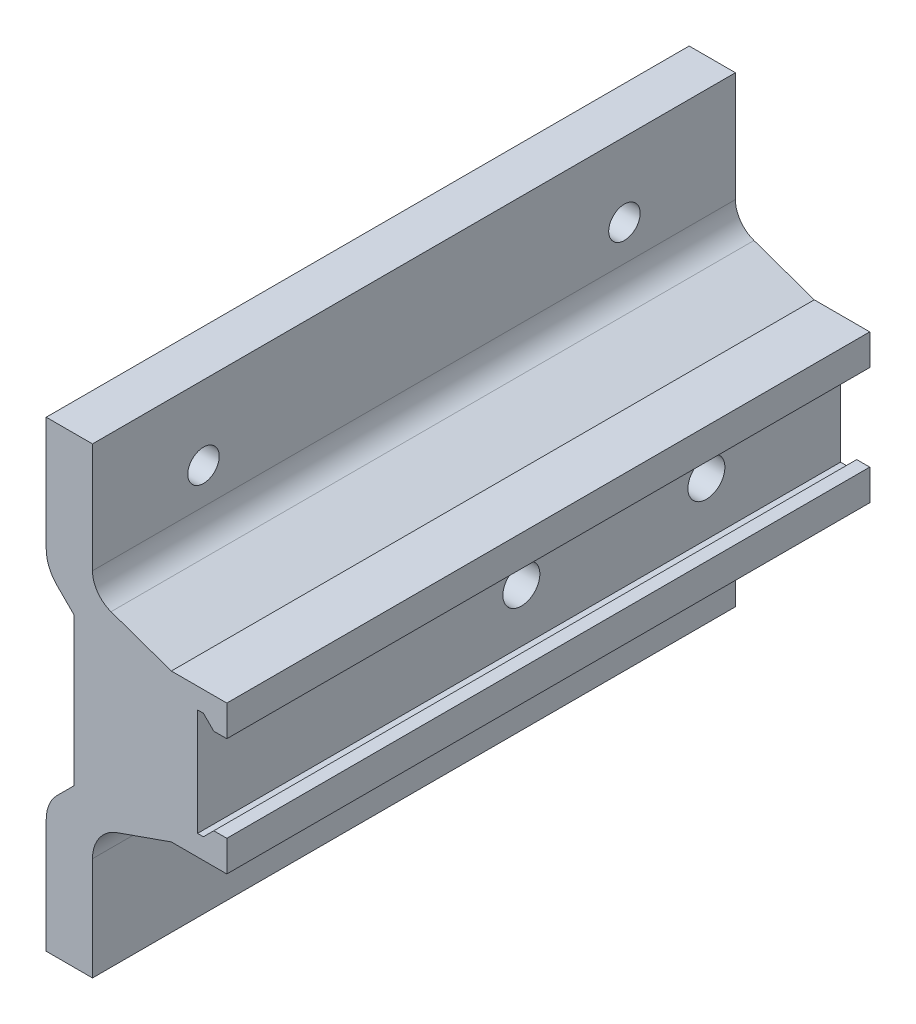
from build123d import *

# Parameters (mm, degrees)
BOSS_EXTRUDE2_DEPTH     = 69.5
BOSS_EXTRUDE3_DEPTH     = 69.5
CUT_EXTRUDE1_DEPTH      = 77.467274154
CUT_EXTRUDE1_DEPTH_BACK = 77.467274154
SKETCH7_R               = 2
CUT_EXTRUDE2_DEPTH      = 78.205129928
CUT_EXTRUDE2_DEPTH_BACK = 78.205129928
SKETCH8_R               = 1.7


with BuildPart() as part:
    # Sketch4 → Boss-Extrude2 (new body)
    with BuildSketch(Plane.XY):
        Polygon((-4.302602112, 10.373468411), (-10.302602112, 10.373468411), (-10.302602112, -5.626531589), (-4.302602112, -5.626531589), (-4.302602112, -2.286531589), (-5.712602112, -2.286531589), (-6.832602112, -3.406531589), (-7.462602112, -3.406531589), (-7.462602112, 8.153468411), (-6.832602112, 8.153468411), (-5.712602112, 7.033468411), (-4.302602112, 7.033468411), align=None)
    extrude(amount=BOSS_EXTRUDE2_DEPTH)

    # Sketch6 → Boss-Extrude3 (add)
    with BuildSketch(Plane.XY.offset(69.5)):
        with BuildLine():
            Line((-18.82375255, 27.373468411), (-23.82375255, 27.373468411))
            Line((-23.82375255, 27.373468411), (-23.82375255, 15.03032266))
            ThreePointArc((-23.82375255, 15.03032266), (-23.51927068, 13.499588931), (-22.652179675, 12.201895535))
            Line((-22.652179675, 12.201895535), (-20.82375255, 10.373468411))
            Line((-20.82375255, 10.373468411), (-20.82375255, -5.626531589))
            Line((-20.82375255, -5.626531589), (-22.652179675, -7.454958714))
            ThreePointArc((-22.652179675, -7.454958714), (-23.51927068, -8.752652109), (-23.82375255, -10.283385839))
            Line((-23.82375255, -10.283385839), (-23.82375255, -22.626531589))
            Line((-23.82375255, -22.626531589), (-18.82375255, -22.626531589))
            Line((-18.82375255, -22.626531589), (-18.82375255, -11.458931103))
            ThreePointArc((-18.82375255, -11.458931103), (-18.088209901, -9.14736925), (-16.152093449, -7.685933561))
            Line((-16.152093449, -7.685933561), (-10.302602112, -5.626531589))
            Line((-10.302602112, -5.626531589), (-10.302602112, 10.373468411))
            Line((-10.302602112, 10.373468411), (-16.820008224, 12.668019889))
            ThreePointArc((-16.820008224, 12.668019889), (-18.272095564, 13.764096656), (-18.82375255, 15.497768046))
            Line((-18.82375255, 15.497768046), (-18.82375255, 27.373468411))
        make_face()
    extrude(amount=-BOSS_EXTRUDE3_DEPTH)

    # Sketch7 → Cut-Extrude1 (cut, two sides: drawn at the far end of the back side and taken through both)
    with BuildSketch(Plane(origin=(-7.462602112, 0, 0), x_dir=(0, 0, -1), z_dir=(1, 0, 0)).offset(-CUT_EXTRUDE1_DEPTH_BACK)):
        with Locations(Location((-34.5, 2.373468411, 0), (0, 0, 180))):
            Circle(SKETCH7_R)
        with Locations(Location((-14.5, 2.373468411, 0), (0, 0, 180))):
            Circle(SKETCH7_R)
    extrude(amount=CUT_EXTRUDE1_DEPTH + CUT_EXTRUDE1_DEPTH_BACK, mode=Mode.SUBTRACT)

    # Sketch8 → Cut-Extrude2 (cut, two sides: drawn at the far end of the back side and taken through both)
    with BuildSketch(Plane.ZY.offset(23.82375255).offset(-CUT_EXTRUDE2_DEPTH_BACK)):
        with Locations(Location((12, 19.373468411, 0), (0, 0, 270))):
            Circle(SKETCH8_R)
        with Locations(Location((57.5, 19.373468411, 0), (0, 0, 270))):
            Circle(SKETCH8_R)
        with Locations(Location((57.5, -14.626531589, 0), (0, 0, 270))):
            Circle(SKETCH8_R)
        with Locations(Location((12, -14.626531589, 0), (0, 0, 270))):
            Circle(SKETCH8_R)
    extrude(amount=CUT_EXTRUDE2_DEPTH + CUT_EXTRUDE2_DEPTH_BACK, mode=Mode.SUBTRACT)


solid = part.part
